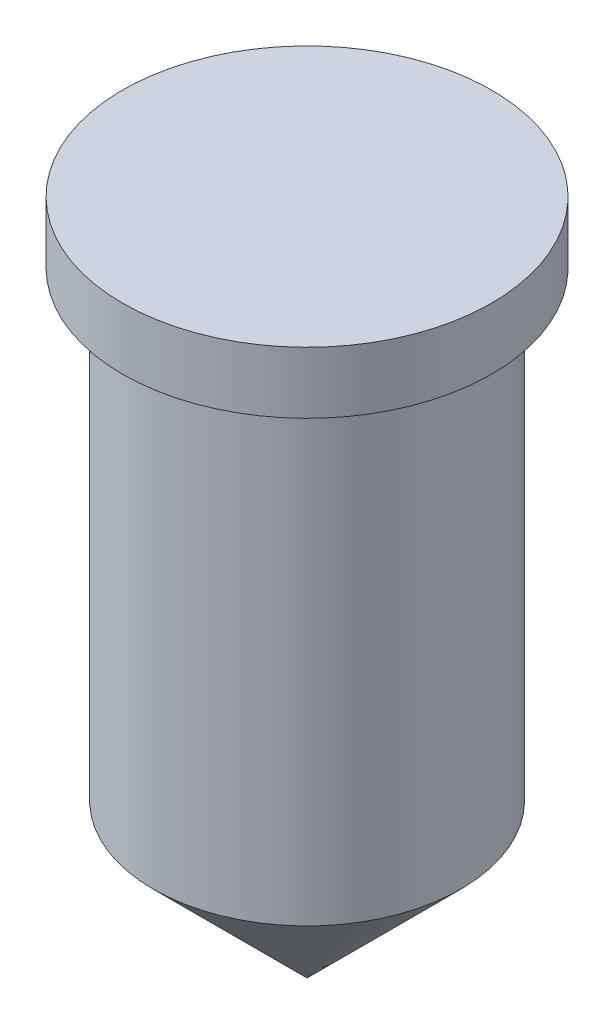
from build123d import *

# Parameters (mm, degrees)
SZKIC1_R                    = 2.5
DODANIE_WYCI_GNI_CIE1_DEPTH = 10
SFAZOWANIE1_SIZE            = 2.5
SZKIC3_R                    = 3
DODANIE_WYCI_GNI_CIE2_DEPTH = 1


with BuildPart() as part:
    # Szkic1 → Dodanie-wyciągnięcie1 (new body)
    with BuildSketch(Plane(origin=(0, 0, 0), x_dir=(1, 0, 0), z_dir=(0, 1, 0))):
        with Locations(Location((0, 0, 0), (0, 0, 270))):
            Circle(SZKIC1_R)
    extrude(amount=DODANIE_WYCI_GNI_CIE1_DEPTH)

    # Sfazowanie1
    sfazowanie1_edges = [part.edges().sort_by_distance(p)[0] for p in [
        (0, 0, -2.5),
    ]]
    chamfer(sfazowanie1_edges, length=SFAZOWANIE1_SIZE)

    # Szkic3 → Dodanie-wyciągnięcie2 (add)
    with BuildSketch(Plane(origin=(0, 10, 0), x_dir=(1, 0, 0), z_dir=(0, 1, 0))):
        with Locations(Location((0, 0, 0), (0, 0, 270))):
            Circle(SZKIC3_R)
    extrude(amount=DODANIE_WYCI_GNI_CIE2_DEPTH)


solid = part.part
